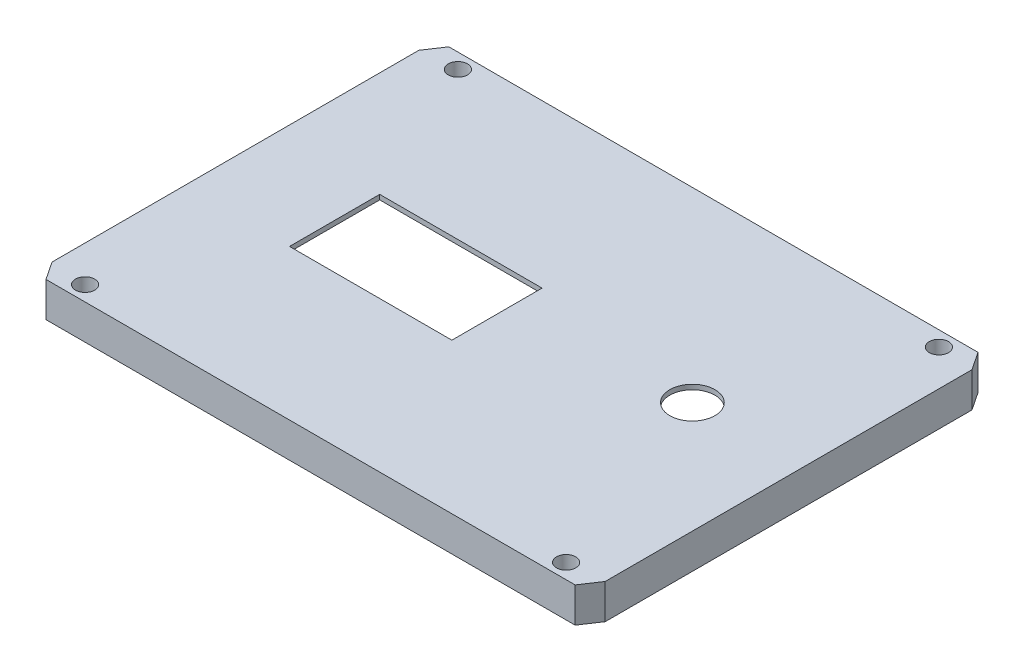
from build123d import *
from OCP.BRepFilletAPI import BRepFilletAPI_MakeChamfer

# Parameters (mm, degrees)
SKETCH1_W           = 92
SKETCH1_H           = 67
SKETCH1_W_2         = 88
SKETCH1_H_2         = 57
BOSS_EXTRUDE1_DEPTH = 25
SKETCH2_W           = 92
SKETCH2_H           = 67
BOSS_EXTRUDE2_DEPTH = 0.8
CUT_EXTRUDE1_REACH  = 103.051
SKETCH3_W           = 11
SKETCH3_H           = 7
CUT_EXTRUDE2_DEPTH  = 8
CHAMFER1_SIZE       = 3
CHAMFER1_SIZE2      = 2
CHAMFER2_SIZE       = 2
CHAMFER2_SIZE2      = 3
BOSS_EXTRUDE3_START = 0.8
SKETCH6_R           = 1.6
SKETCH6_W           = 88
SKETCH6_H           = 57
SKETCH6_R_2         = 3.75
SKETCH6_W_2         = 27
SKETCH6_H_2         = 15
BOSS_EXTRUDE3_DEPTH = 0.8
CUT_EXTRUDE3_DEPTH  = 20.8


with BuildPart() as part:
    # Sketch1 → Boss-Extrude1 (new body)
    with BuildSketch(Plane(origin=(0, 0, 0), x_dir=(1, 0, 0), z_dir=(0, 1, 0))):
        Rectangle(SKETCH1_W, SKETCH1_H)
        Rectangle(SKETCH1_W_2, SKETCH1_H_2, mode=Mode.SUBTRACT)
    extrude(amount=BOSS_EXTRUDE1_DEPTH)

    # Sketch2 → Boss-Extrude2 (add)
    with BuildSketch(Plane.XZ):
        Rectangle(SKETCH2_W, SKETCH2_H)
    extrude(amount=BOSS_EXTRUDE2_DEPTH)

    # Sketch3 → Cut-Extrude1 (cut, up to next)
    with BuildSketch(Plane.ZY.offset(46), mode=Mode.PRIVATE) as cut_extrude1_sk1:
        with Locations((0, 15)):
            Rectangle(SKETCH3_W, SKETCH3_H)
    cut_extrude1_tool1 = extrude(cut_extrude1_sk1.sketch, amount=-CUT_EXTRUDE1_REACH, mode=Mode.PRIVATE) & part.part
    add(cut_extrude1_tool1.solids().sort_by_distance((-46, 15, 0))[0], mode=Mode.SUBTRACT)

    # Sketch4 → Cut-Extrude2 (cut)
    with BuildSketch(Plane(origin=(0, 25, 0), x_dir=(1, 0, 0), z_dir=(0, 1, 0))):
        with BuildLine():
            ThreePointArc((-38.4, 31), (-41.13137085, 32.13137085), (-40, 29.4))
            Line((-40, 29.4), (-40, 31))
            Line((-40, 31), (-38.4, 31))
        make_face()
        with BuildLine():
            Line((-40, 31), (-40, 29.4))
            ThreePointArc((-40, 29.4), (-38.86862915, 29.86862915), (-38.4, 31))
            Line((-38.4, 31), (-40, 31))
        make_face()
        with BuildLine():
            ThreePointArc((-40, -29.4), (-41.13137085, -32.13137085), (-38.4, -31))
            Line((-38.4, -31), (-40, -31))
            Line((-40, -31), (-40, -29.4))
        make_face()
        with BuildLine():
            Line((-40, -31), (-38.4, -31))
            ThreePointArc((-38.4, -31), (-38.86862915, -29.86862915), (-40, -29.4))
            Line((-40, -29.4), (-40, -31))
        make_face()
        with BuildLine():
            ThreePointArc((40, -29.4), (38.86862915, -29.86862915), (38.4, -31))
            Line((38.4, -31), (40, -31))
            Line((40, -31), (40, -29.4))
        make_face()
        with BuildLine():
            Line((40, -31), (38.4, -31))
            ThreePointArc((38.4, -31), (40, -32.6), (41.6, -31))
            ThreePointArc((41.6, -31), (41.13137085, -29.86862915), (40, -29.4))
            Line((40, -29.4), (40, -31))
        make_face()
        with BuildLine():
            ThreePointArc((38.4, 31), (38.86862915, 29.86862915), (40, 29.4))
            Line((40, 29.4), (40, 31))
            Line((40, 31), (38.4, 31))
        make_face()
        with BuildLine():
            Line((40, 31), (40, 29.4))
            ThreePointArc((40, 29.4), (41.13137085, 29.86862915), (41.6, 31))
            ThreePointArc((41.6, 31), (40, 32.6), (38.4, 31))
            Line((38.4, 31), (40, 31))
        make_face()
    extrude(amount=-CUT_EXTRUDE2_DEPTH, mode=Mode.SUBTRACT)

    # Chamfer1: one chamfer whose edges measure the first distance from different faces: ONE call of the kernel's chamfer builder (chamfer() names one face for all edges)
    chamfer1_edges_1 = [part.edges().sort_by_distance(p)[0] for p in [
        (46, 12.1, -33.5),
    ]]
    chamfer1_side_1 = [part.faces().sort_by_distance(p)[0] for p in [
        (46, 12.1, 0),
    ]]
    chamfer1_edges_2 = [part.edges().sort_by_distance(p)[0] for p in [
        (-46, 12.1, 33.5),
    ]]
    chamfer1_side_2 = [part.faces().sort_by_distance(p)[0] for p in [
        (-46, 12.1, 32.782041784),
    ]]
    chamfer1 = BRepFilletAPI_MakeChamfer(part.part.solid().wrapped)
    for e in chamfer1_edges_1:
        chamfer1.Add(CHAMFER1_SIZE, CHAMFER1_SIZE2, e.wrapped, chamfer1_side_1[0].wrapped)  # the first distance lies on this face
    for e in chamfer1_edges_2:
        chamfer1.Add(CHAMFER1_SIZE, CHAMFER1_SIZE2, e.wrapped, chamfer1_side_2[0].wrapped)  # the first distance lies on this face
    add(Compound.cast(chamfer1.Shape()), mode=Mode.REPLACE)

    # Chamfer2: one chamfer whose edges measure the first distance from different faces: ONE call of the kernel's chamfer builder (chamfer() names one face for all edges)
    chamfer2_edges_1 = [part.edges().sort_by_distance(p)[0] for p in [
        (-46, 12.1, -33.5),
    ]]
    chamfer2_side_1 = [part.faces().sort_by_distance(p)[0] for p in [
        (-1, 12.1, -33.5),
    ]]
    chamfer2_edges_2 = [part.edges().sort_by_distance(p)[0] for p in [
        (46, 12.1, 33.5),
    ]]
    chamfer2_side_2 = [part.faces().sort_by_distance(p)[0] for p in [
        (1, 12.1, 33.5),
    ]]
    chamfer2 = BRepFilletAPI_MakeChamfer(part.part.solid().wrapped)
    for e in chamfer2_edges_1:
        chamfer2.Add(CHAMFER2_SIZE, CHAMFER2_SIZE2, e.wrapped, chamfer2_side_1[0].wrapped)  # the first distance lies on this face
    for e in chamfer2_edges_2:
        chamfer2.Add(CHAMFER2_SIZE, CHAMFER2_SIZE2, e.wrapped, chamfer2_side_2[0].wrapped)  # the first distance lies on this face
    add(Compound.cast(chamfer2.Shape()), mode=Mode.REPLACE)

    # Sketch6 → Boss-Extrude3 (add)
    # profile 1 of 2: a face of its own
    with BuildSketch(Plane(origin=(0, 25, 0), x_dir=(1, 0, 0), z_dir=(0, 1, 0)).offset(BOSS_EXTRUDE3_START)):
        Polygon((46, 30.5), (44, 33.5), (-44, 33.5), (-46, 30.5), (-46, -30.5), (-44, -33.5), (44, -33.5), (46, -30.5), align=None)
        with Locations(Location((40, -31, 0), (0, 0, 270))):
            Circle(SKETCH6_R, mode=Mode.SUBTRACT)
        with Locations(Location((-40, 31, 0), (0, 0, 270))):
            Circle(SKETCH6_R, mode=Mode.SUBTRACT)
        with Locations(Location((-40, -31, 0), (0, 0, 270))):
            Circle(SKETCH6_R, mode=Mode.SUBTRACT)
        with Locations(Location((40, 31, 0), (0, 0, 270))):
            Circle(SKETCH6_R, mode=Mode.SUBTRACT)
        Rectangle(SKETCH6_W, SKETCH6_H, mode=Mode.SUBTRACT)
    # profile 2 of 2: a face of its own
    with BuildSketch(Plane(origin=(0, 25, 0), x_dir=(1, 0, 0), z_dir=(0, 1, 0)).offset(BOSS_EXTRUDE3_START)):
        Rectangle(SKETCH6_W, SKETCH6_H)
        with Locations(Location((27.5, 2.5, 0), (0, 0, 270))):
            Circle(SKETCH6_R_2, mode=Mode.SUBTRACT)
        with Locations((-15, -1)):
            Rectangle(SKETCH6_W_2, SKETCH6_H_2, mode=Mode.SUBTRACT)
    extrude(amount=-BOSS_EXTRUDE3_DEPTH)

    # Sketch7 → Cut-Extrude3 (cut)
    with BuildSketch(Plane.XZ.offset(0.8)):
        Polygon((-46, 30.5), (-46, -30.5), (-44, -33.5), (44, -33.5), (46, -30.5), (46, 30.5), (44, 33.5), (-44, 33.5), align=None)
    extrude(amount=-CUT_EXTRUDE3_DEPTH, mode=Mode.SUBTRACT)


solid = part.part
